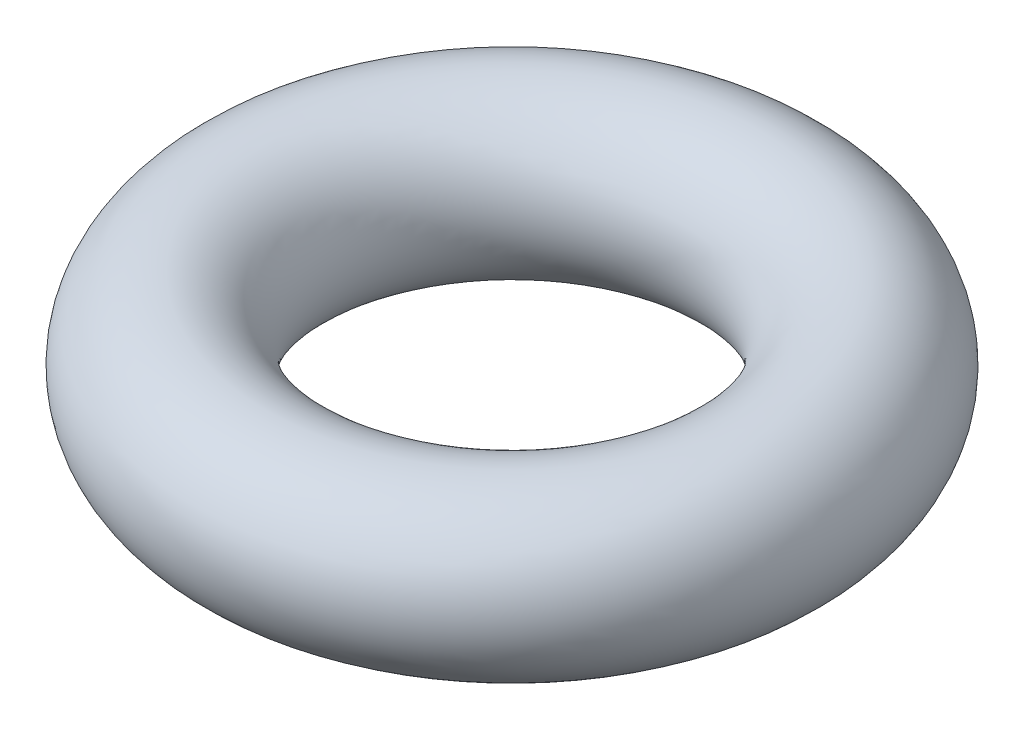
from build123d import *

# Parameters (mm, degrees)
MAINBODYS_R = 0.5


with BuildPart() as part:
    # MainBodyS → MAIN BODY (revolve)
    with BuildSketch(Plane.XY):
        with Locations((1.5, 0)):
            Circle(MAINBODYS_R)
    revolve(axis=Axis((0, 0, 0), (0, -1, 0)))


solid = part.part
